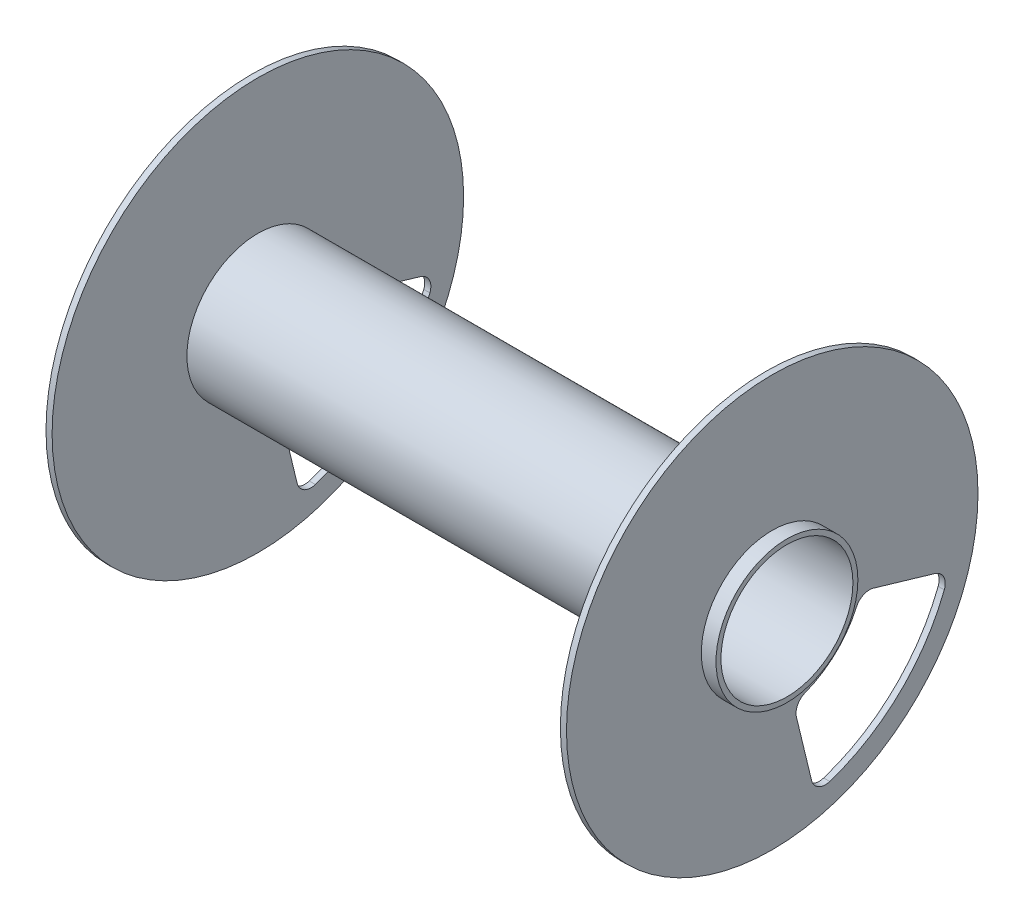
from build123d import *

# Parameters (mm, degrees)
CUT_EXTRUDE1_DEPTH      = 111.87459973
CUT_EXTRUDE1_DEPTH_BACK = 111.87459973


with BuildPart() as part:
    # Sketch2 → Revolve1 (revolve)
    with BuildSketch(Plane.XY):
        Polygon((-52.3875, 11.811), (-52.3875, 12.7), (-46.5836, 12.7), (-46.5836, 36.83), (-45.4914, 36.83), (-45.4914, 12.7), (45.4914, 12.7), (45.4914, 36.83), (46.5836, 36.83), (46.5836, 12.7), (49.2125, 12.7), (49.2125, 11.811), (26.91765, 11.811), (26.91765, 9.36625), (20.70735, 9.36625), (20.70735, 11.811), align=None)
    revolve(axis=Axis((0, 0, 0), (-1, 0, 0)))

    # Sketch3 → Cut-Extrude1 (cut, two sides: drawn at the far end of the back side and taken through both)
    with BuildSketch(Plane.ZY.offset(-45.4914).offset(-CUT_EXTRUDE1_DEPTH_BACK)):
        with BuildLine():
            Line((-18.112952688, -5.32652278), (-29.140106204, -8.569306297))
            ThreePointArc((-29.140106204, -8.569306297), (-30.702095808, -9.883795088), (-30.792130213, -11.923301428))
            ThreePointArc((-30.792130213, -11.923301428), (-22.728159534, -23.953103435), (-10.291997319, -31.375072768))
            ThreePointArc((-10.291997319, -31.375072768), (-8.264508496, -31.180706004), (-7.031658144, -29.559419671))
            Line((-7.031658144, -29.559419671), (-4.327850892, -18.394165222))
            ThreePointArc((-4.327850892, -18.394165222), (-4.548475673, -16.613982469), (-5.890298237, -15.423504358))
            ThreePointArc((-5.890298237, -15.423504358), (-11.349323888, -11.990535738), (-15.076837789, -6.728228762))
            ThreePointArc((-15.076837789, -6.728228762), (-16.331679174, -5.457246069), (-18.112952688, -5.32652278))
        make_face()
    extrude(amount=CUT_EXTRUDE1_DEPTH + CUT_EXTRUDE1_DEPTH_BACK, mode=Mode.SUBTRACT)


solid = part.part
